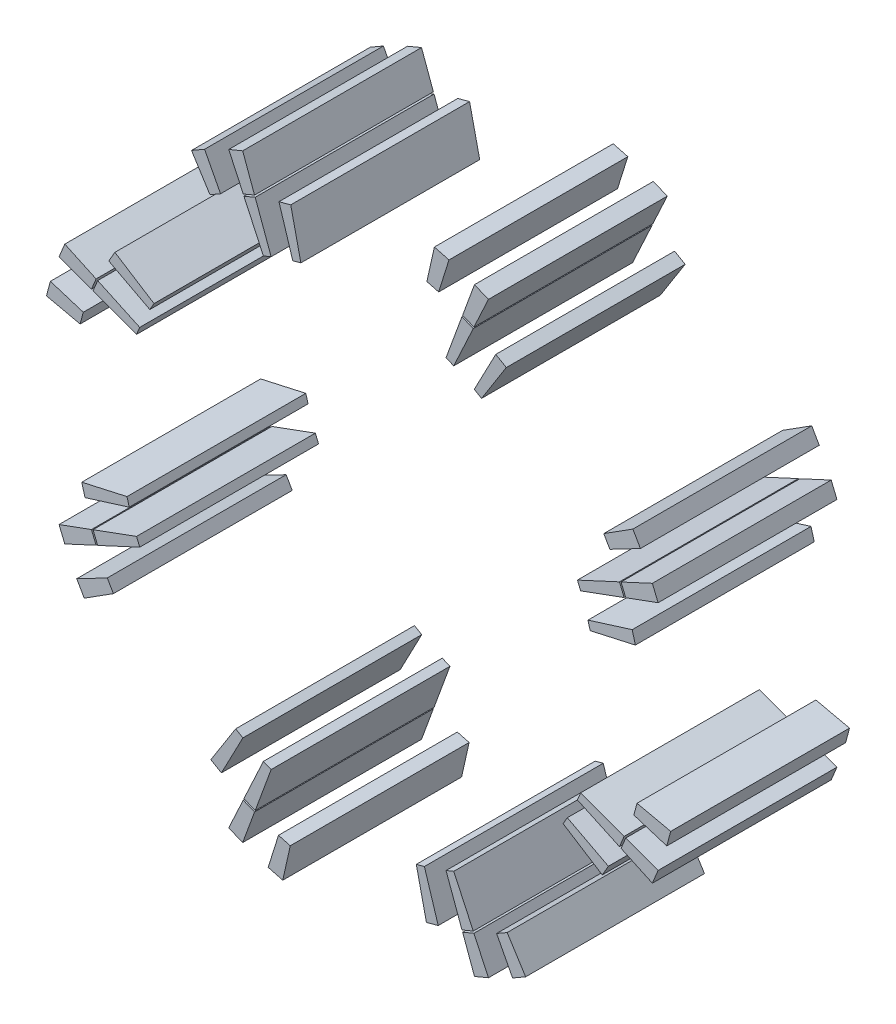
from build123d import *

# Parameters (mm, degrees)
SLOT_COPPER_ENVELOPES_START    = -20
SLOT_COPPER_ENVELOPES_DEPTH    = 40
SLOT_COPPER_ENVELOPES_2_DEPTH  = 40
SLOT_COPPER_ENVELOPES_3_DEPTH  = 40
SLOT_COPPER_ENVELOPES_4_DEPTH  = 40
SLOT_COPPER_ENVELOPES_5_DEPTH  = 40
SLOT_COPPER_ENVELOPES_6_DEPTH  = 40
SLOT_COPPER_ENVELOPES_7_DEPTH  = 40
SLOT_COPPER_ENVELOPES_8_DEPTH  = 40
SLOT_COPPER_ENVELOPES_9_DEPTH  = 40
SLOT_COPPER_ENVELOPES_10_DEPTH = 40
SLOT_COPPER_ENVELOPES_11_DEPTH = 40
SLOT_COPPER_ENVELOPES_12_DEPTH = 40
SLOT_COPPER_ENVELOPES_13_DEPTH = 40
SLOT_COPPER_ENVELOPES_14_DEPTH = 40
SLOT_COPPER_ENVELOPES_15_DEPTH = 40
SLOT_COPPER_ENVELOPES_16_DEPTH = 40
SLOT_COPPER_ENVELOPES_17_DEPTH = 40
SLOT_COPPER_ENVELOPES_18_DEPTH = 40
SLOT_COPPER_ENVELOPES_19_DEPTH = 40
SLOT_COPPER_ENVELOPES_20_DEPTH = 40
SLOT_COPPER_ENVELOPES_21_DEPTH = 40
SLOT_COPPER_ENVELOPES_22_DEPTH = 40
SLOT_COPPER_ENVELOPES_23_DEPTH = 40
SLOT_COPPER_ENVELOPES_24_DEPTH = 40
SLOT_COPPER_ENVELOPES_25_DEPTH = 40
SLOT_COPPER_ENVELOPES_26_DEPTH = 40
SLOT_COPPER_ENVELOPES_27_DEPTH = 40
SLOT_COPPER_ENVELOPES_28_DEPTH = 40
SLOT_COPPER_ENVELOPES_29_DEPTH = 40
SLOT_COPPER_ENVELOPES_30_DEPTH = 40
SLOT_COPPER_ENVELOPES_31_DEPTH = 40
SLOT_COPPER_ENVELOPES_32_DEPTH = 40


with BuildPart() as part:
    # Эскиз1 → Slot_copper_envelopes (new body)
    with BuildSketch(Plane.XY.offset(SLOT_COPPER_ENVELOPES_START)):
        Polygon((51.792838285, 12.907277773), (61.904994905, 15.174476696), (61.198536557, 17.811015145), (51.307552576, 14.718388697), align=None)
    extrude(amount=SLOT_COPPER_ENVELOPES_DEPTH)


with BuildPart() as body_2:
    # Эскиз1 → Slot_copper_envelopes 2 (new body)
    with BuildSketch(Plane.XY.offset(SLOT_COPPER_ENVELOPES_START)):
        Polygon((59.750854603, 23.272394985), (66.994542258, 25.92351117), (65.702985673, 29.041604592), (58.706302779, 25.794166163), align=None)
    extrude(amount=SLOT_COPPER_ENVELOPES_2_DEPTH)


with BuildPart() as body_3:
    # Эскиз1 → Slot_copper_envelopes 3 (new body)
    with BuildSketch(Plane.XY.offset(SLOT_COPPER_ENVELOPES_START)):
        Polygon((49.665005554, 19.557176188), (59.39472243, 23.124880209), (58.350170606, 25.646651387), (48.947474119, 21.289450312), align=None)
    extrude(amount=SLOT_COPPER_ENVELOPES_3_DEPTH)


with BuildPart() as body_4:
    # Эскиз1 → Slot_copper_envelopes 4 (new body)
    with BuildSketch(Plane.XY.offset(SLOT_COPPER_ENVELOPES_START)):
        Polygon((56.202020657, 30.872347953), (63.037697459, 34.446274439), (61.350197459, 37.369110177), (54.83724793, 33.236203657), align=None)
    extrude(amount=SLOT_COPPER_ENVELOPES_4_DEPTH)


with BuildPart() as body_5:
    # Эскиз1 → Slot_copper_envelopes 5 (new body)
    with BuildSketch(Plane.XY.offset(SLOT_COPPER_ENVELOPES_START)):
        Polygon((27.496243528, 45.749890808), (33.043466314, 54.503417059), (30.679610609, 55.868189786), (25.872445896, 46.687390808), align=None)
    extrude(amount=SLOT_COPPER_ENVELOPES_5_DEPTH)


with BuildPart() as body_6:
    # Эскиз1 → Slot_copper_envelopes 6 (new body)
    with BuildSketch(Plane.XY.offset(SLOT_COPPER_ENVELOPES_START)):
        Polygon((25.794166163, 58.706302779), (29.041604592, 65.702985673), (25.92351117, 66.994542258), (23.272394985, 59.750854603), align=None)
    extrude(amount=SLOT_COPPER_ENVELOPES_6_DEPTH)


with BuildPart() as body_7:
    # Эскиз1 → Slot_copper_envelopes 7 (new body)
    with BuildSketch(Plane.XY.offset(SLOT_COPPER_ENVELOPES_START)):
        Polygon((21.289450312, 48.947474119), (25.646651387, 58.350170606), (23.124880209, 59.39472243), (19.557176188, 49.665005554), align=None)
    extrude(amount=SLOT_COPPER_ENVELOPES_7_DEPTH)


with BuildPart() as body_8:
    # Эскиз1 → Slot_copper_envelopes 8 (new body)
    with BuildSketch(Plane.XY.offset(SLOT_COPPER_ENVELOPES_START)):
        Polygon((17.910783335, 61.570876512), (20.217189102, 68.931577586), (16.957189438, 69.805091863), (15.274244886, 62.27733486), align=None)
    extrude(amount=SLOT_COPPER_ENVELOPES_8_DEPTH)


with BuildPart() as body_9:
    # Эскиз1 → Slot_copper_envelopes 9 (new body)
    with BuildSketch(Plane.XY.offset(SLOT_COPPER_ENVELOPES_START)):
        Polygon((-12.907277773, 51.792838285), (-15.174476696, 61.904994905), (-17.811015145, 61.198536557), (-14.718388697, 51.307552576), align=None)
    extrude(amount=SLOT_COPPER_ENVELOPES_9_DEPTH)


with BuildPart() as body_10:
    # Эскиз1 → Slot_copper_envelopes 10 (new body)
    with BuildSketch(Plane.XY.offset(SLOT_COPPER_ENVELOPES_START)):
        Polygon((-23.272394985, 59.750854603), (-25.92351117, 66.994542258), (-29.041604592, 65.702985673), (-25.794166163, 58.706302779), align=None)
    extrude(amount=SLOT_COPPER_ENVELOPES_10_DEPTH)


with BuildPart() as body_11:
    # Эскиз1 → Slot_copper_envelopes 11 (new body)
    with BuildSketch(Plane.XY.offset(SLOT_COPPER_ENVELOPES_START)):
        Polygon((-19.557176188, 49.665005554), (-23.124880209, 59.39472243), (-25.646651387, 58.350170606), (-21.289450312, 48.947474119), align=None)
    extrude(amount=SLOT_COPPER_ENVELOPES_11_DEPTH)


with BuildPart() as body_12:
    # Эскиз1 → Slot_copper_envelopes 12 (new body)
    with BuildSketch(Plane.XY.offset(SLOT_COPPER_ENVELOPES_START)):
        Polygon((-30.872347953, 56.202020657), (-34.446274439, 63.037697459), (-37.369110177, 61.350197459), (-33.236203657, 54.83724793), align=None)
    extrude(amount=SLOT_COPPER_ENVELOPES_12_DEPTH)


with BuildPart() as body_13:
    # Эскиз1 → Slot_copper_envelopes 13 (new body)
    with BuildSketch(Plane.XY.offset(SLOT_COPPER_ENVELOPES_START)):
        Polygon((-45.749890808, 27.496243528), (-54.503417059, 33.043466314), (-55.868189786, 30.679610609), (-46.687390808, 25.872445896), align=None)
    extrude(amount=SLOT_COPPER_ENVELOPES_13_DEPTH)


with BuildPart() as body_14:
    # Эскиз1 → Slot_copper_envelopes 14 (new body)
    with BuildSketch(Plane.XY.offset(SLOT_COPPER_ENVELOPES_START)):
        Polygon((-58.706302779, 25.794166163), (-65.702985673, 29.041604592), (-66.994542258, 25.92351117), (-59.750854603, 23.272394985), align=None)
    extrude(amount=SLOT_COPPER_ENVELOPES_14_DEPTH)


with BuildPart() as body_15:
    # Эскиз1 → Slot_copper_envelopes 15 (new body)
    with BuildSketch(Plane.XY.offset(SLOT_COPPER_ENVELOPES_START)):
        Polygon((-48.947474119, 21.289450312), (-58.350170606, 25.646651387), (-59.39472243, 23.124880209), (-49.665005554, 19.557176188), align=None)
    extrude(amount=SLOT_COPPER_ENVELOPES_15_DEPTH)


with BuildPart() as body_16:
    # Эскиз1 → Slot_copper_envelopes 16 (new body)
    with BuildSketch(Plane.XY.offset(SLOT_COPPER_ENVELOPES_START)):
        Polygon((-61.570876512, 17.910783335), (-68.931577586, 20.217189102), (-69.805091863, 16.957189438), (-62.27733486, 15.274244886), align=None)
    extrude(amount=SLOT_COPPER_ENVELOPES_16_DEPTH)


with BuildPart() as body_17:
    # Эскиз1 → Slot_copper_envelopes 17 (new body)
    with BuildSketch(Plane.XY.offset(SLOT_COPPER_ENVELOPES_START)):
        Polygon((-51.792838285, -12.907277773), (-61.904994905, -15.174476696), (-61.198536557, -17.811015145), (-51.307552576, -14.718388697), align=None)
    extrude(amount=SLOT_COPPER_ENVELOPES_17_DEPTH)


with BuildPart() as body_18:
    # Эскиз1 → Slot_copper_envelopes 18 (new body)
    with BuildSketch(Plane.XY.offset(SLOT_COPPER_ENVELOPES_START)):
        Polygon((-59.750854603, -23.272394985), (-66.994542258, -25.92351117), (-65.702985673, -29.041604592), (-58.706302779, -25.794166163), align=None)
    extrude(amount=SLOT_COPPER_ENVELOPES_18_DEPTH)


with BuildPart() as body_19:
    # Эскиз1 → Slot_copper_envelopes 19 (new body)
    with BuildSketch(Plane.XY.offset(SLOT_COPPER_ENVELOPES_START)):
        Polygon((-49.665005554, -19.557176188), (-59.39472243, -23.124880209), (-58.350170606, -25.646651387), (-48.947474119, -21.289450312), align=None)
    extrude(amount=SLOT_COPPER_ENVELOPES_19_DEPTH)


with BuildPart() as body_20:
    # Эскиз1 → Slot_copper_envelopes 20 (new body)
    with BuildSketch(Plane.XY.offset(SLOT_COPPER_ENVELOPES_START)):
        Polygon((-56.202020657, -30.872347953), (-63.037697459, -34.446274439), (-61.350197459, -37.369110177), (-54.83724793, -33.236203657), align=None)
    extrude(amount=SLOT_COPPER_ENVELOPES_20_DEPTH)


with BuildPart() as body_21:
    # Эскиз1 → Slot_copper_envelopes 21 (new body)
    with BuildSketch(Plane.XY.offset(SLOT_COPPER_ENVELOPES_START)):
        Polygon((-27.496243528, -45.749890808), (-33.043466314, -54.503417059), (-30.679610609, -55.868189786), (-25.872445896, -46.687390808), align=None)
    extrude(amount=SLOT_COPPER_ENVELOPES_21_DEPTH)


with BuildPart() as body_22:
    # Эскиз1 → Slot_copper_envelopes 22 (new body)
    with BuildSketch(Plane.XY.offset(SLOT_COPPER_ENVELOPES_START)):
        Polygon((-25.794166163, -58.706302779), (-29.041604592, -65.702985673), (-25.92351117, -66.994542258), (-23.272394985, -59.750854603), align=None)
    extrude(amount=SLOT_COPPER_ENVELOPES_22_DEPTH)


with BuildPart() as body_23:
    # Эскиз1 → Slot_copper_envelopes 23 (new body)
    with BuildSketch(Plane.XY.offset(SLOT_COPPER_ENVELOPES_START)):
        Polygon((-21.289450312, -48.947474119), (-25.646651387, -58.350170606), (-23.124880209, -59.39472243), (-19.557176188, -49.665005554), align=None)
    extrude(amount=SLOT_COPPER_ENVELOPES_23_DEPTH)


with BuildPart() as body_24:
    # Эскиз1 → Slot_copper_envelopes 24 (new body)
    with BuildSketch(Plane.XY.offset(SLOT_COPPER_ENVELOPES_START)):
        Polygon((-17.910783335, -61.570876512), (-20.217189102, -68.931577586), (-16.957189438, -69.805091863), (-15.274244886, -62.27733486), align=None)
    extrude(amount=SLOT_COPPER_ENVELOPES_24_DEPTH)


with BuildPart() as body_25:
    # Эскиз1 → Slot_copper_envelopes 25 (new body)
    with BuildSketch(Plane.XY.offset(SLOT_COPPER_ENVELOPES_START)):
        Polygon((12.907277773, -51.792838285), (15.174476696, -61.904994905), (17.811015145, -61.198536557), (14.718388697, -51.307552576), align=None)
    extrude(amount=SLOT_COPPER_ENVELOPES_25_DEPTH)


with BuildPart() as body_26:
    # Эскиз1 → Slot_copper_envelopes 26 (new body)
    with BuildSketch(Plane.XY.offset(SLOT_COPPER_ENVELOPES_START)):
        Polygon((23.272394985, -59.750854603), (25.92351117, -66.994542258), (29.041604592, -65.702985673), (25.794166163, -58.706302779), align=None)
    extrude(amount=SLOT_COPPER_ENVELOPES_26_DEPTH)


with BuildPart() as body_27:
    # Эскиз1 → Slot_copper_envelopes 27 (new body)
    with BuildSketch(Plane.XY.offset(SLOT_COPPER_ENVELOPES_START)):
        Polygon((19.557176188, -49.665005554), (23.124880209, -59.39472243), (25.646651387, -58.350170606), (21.289450312, -48.947474119), align=None)
    extrude(amount=SLOT_COPPER_ENVELOPES_27_DEPTH)


with BuildPart() as body_28:
    # Эскиз1 → Slot_copper_envelopes 28 (new body)
    with BuildSketch(Plane.XY.offset(SLOT_COPPER_ENVELOPES_START)):
        Polygon((30.872347953, -56.202020657), (34.446274439, -63.037697459), (37.369110177, -61.350197459), (33.236203657, -54.83724793), align=None)
    extrude(amount=SLOT_COPPER_ENVELOPES_28_DEPTH)


with BuildPart() as body_29:
    # Эскиз1 → Slot_copper_envelopes 29 (new body)
    with BuildSketch(Plane.XY.offset(SLOT_COPPER_ENVELOPES_START)):
        Polygon((45.749890808, -27.496243528), (54.503417059, -33.043466314), (55.868189786, -30.679610609), (46.687390808, -25.872445896), align=None)
    extrude(amount=SLOT_COPPER_ENVELOPES_29_DEPTH)


with BuildPart() as body_30:
    # Эскиз1 → Slot_copper_envelopes 30 (new body)
    with BuildSketch(Plane.XY.offset(SLOT_COPPER_ENVELOPES_START)):
        Polygon((58.706302779, -25.794166163), (65.702985673, -29.041604592), (66.994542258, -25.92351117), (59.750854603, -23.272394985), align=None)
    extrude(amount=SLOT_COPPER_ENVELOPES_30_DEPTH)


with BuildPart() as body_31:
    # Эскиз1 → Slot_copper_envelopes 31 (new body)
    with BuildSketch(Plane.XY.offset(SLOT_COPPER_ENVELOPES_START)):
        Polygon((48.947474119, -21.289450312), (58.350170606, -25.646651387), (59.39472243, -23.124880209), (49.665005554, -19.557176188), align=None)
    extrude(amount=SLOT_COPPER_ENVELOPES_31_DEPTH)


with BuildPart() as body_32:
    # Эскиз1 → Slot_copper_envelopes 32 (new body)
    with BuildSketch(Plane.XY.offset(SLOT_COPPER_ENVELOPES_START)):
        Polygon((61.570876512, -17.910783335), (68.931577586, -20.217189102), (69.805091863, -16.957189438), (62.27733486, -15.274244886), align=None)
    extrude(amount=SLOT_COPPER_ENVELOPES_32_DEPTH)


solid = Compound([part.part, body_2.part, body_3.part, body_4.part, body_5.part, body_6.part, body_7.part, body_8.part, body_9.part, body_10.part, body_11.part, body_12.part, body_13.part, body_14.part, body_15.part, body_16.part, body_17.part, body_18.part, body_19.part, body_20.part, body_21.part, body_22.part, body_23.part, body_24.part, body_25.part, body_26.part, body_27.part, body_28.part, body_29.part, body_30.part, body_31.part, body_32.part])
